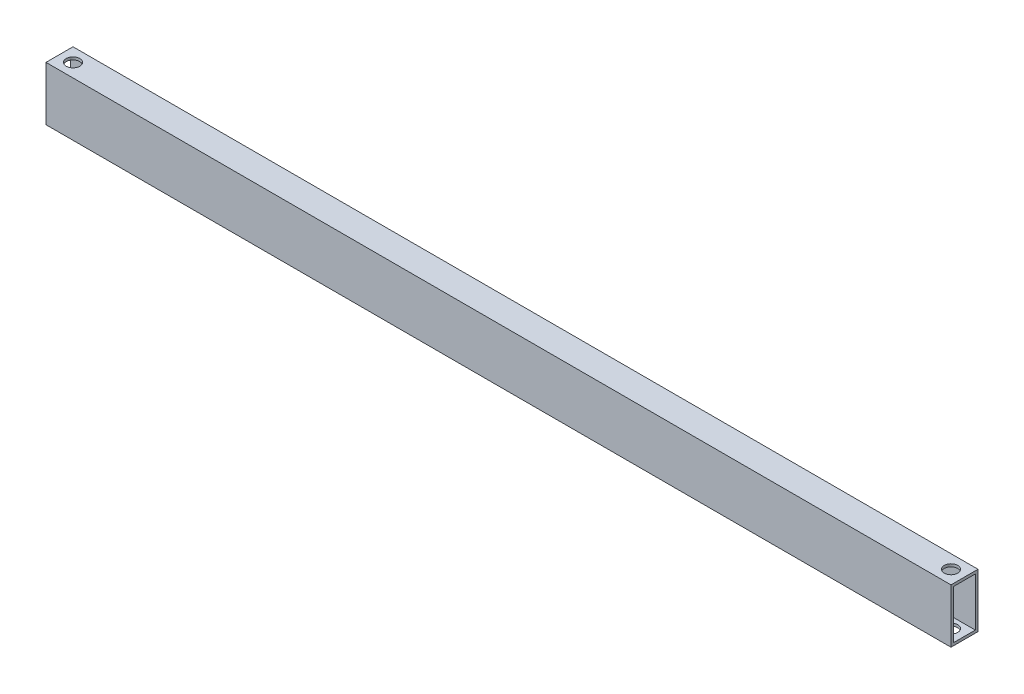
from build123d import *

# Parameters (mm, degrees)
BOSS_EXTRUDE1_DEPTH      = 225
BOSS_EXTRUDE1_DEPTH_BACK = 110
SKETCH1_W                = 10
SKETCH1_H                = 20
SKETCH1_W_2              = 8
SKETCH1_H_2              = 18
SKETCH3_R                = 2.5
CUT_EXTRUDE1_DEPTH       = 1
SKETCH4_R                = 2.5
CUT_EXTRUDE2_DEPTH       = 20


with BuildPart() as part:
    # Sketch1 → Boss-Extrude1 (new, two sides: drawn at the far end of the back side and taken through both)
    with BuildSketch(Plane(origin=(0, 0, 0), x_dir=(0, 0, -1), z_dir=(1, 0, 0)).offset(-BOSS_EXTRUDE1_DEPTH_BACK)):
        with Locations((0, 3.989361702)):
            Rectangle(SKETCH1_W, SKETCH1_H)
        with Locations((0, 3.989361702)):
            Rectangle(SKETCH1_W_2, SKETCH1_H_2, mode=Mode.SUBTRACT)
    extrude(amount=BOSS_EXTRUDE1_DEPTH + BOSS_EXTRUDE1_DEPTH_BACK)

    # Sketch3 → Cut-Extrude1 (cut)
    with BuildSketch(Plane(origin=(0, 0, -5), x_dir=(-1, 0, 0), z_dir=(0, 0, -1))):
        with Locations((-19.85, 3.989361702)):
            Circle(SKETCH3_R)
        with Locations((-10, 3.989361702)):
            Circle(SKETCH3_R)
        with Locations((0, 3.989361702)):
            Circle(SKETCH3_R)
        with Locations(Location((10, 3.989361702, 0), (0, 0, 180))):
            Circle(SKETCH3_R)
        with Locations(Location((19.85, 3.989361702, 0), (0, 0, 180))):
            Circle(SKETCH3_R)
    extrude(amount=-CUT_EXTRUDE1_DEPTH, mode=Mode.SUBTRACT)

    # Sketch4 → Cut-Extrude2 (cut)
    with BuildSketch(Plane(origin=(0, 13.989361702, 0), x_dir=(1, 0, 0), z_dir=(0, 1, 0))):
        with Locations(Location((-105, 0, 0), (0, 0, 270))):
            Circle(SKETCH4_R)
        with Locations(Location((220, 0, 0), (0, 0, 270))):
            Circle(SKETCH4_R)
    extrude(amount=-CUT_EXTRUDE2_DEPTH, mode=Mode.SUBTRACT)


solid = part.part
